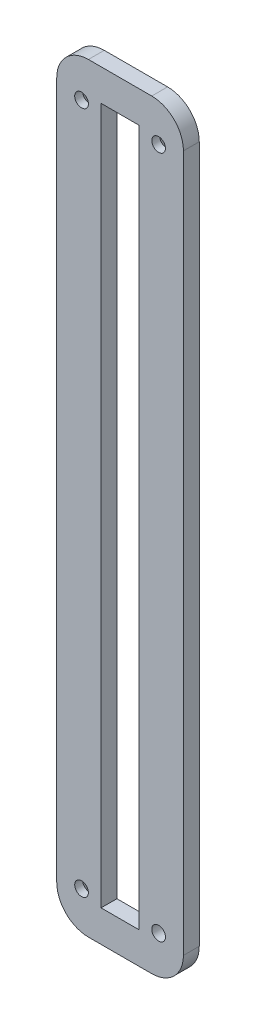
from build123d import *
from build123d.topology import SkipClean

# Parameters (mm, degrees)
SKETCH1_W           = 15.24
SKETCH1_H           = 279.4
BOSS_EXTRUDE3_DEPTH = 6.35
SKETCH2_R           = 2.75
CUT_EXTRUDE1_DEPTH  = 174.437553604
CHAMFER1_SIZE       = 3.175


with BuildPart() as part:
    # Sketch1 → Boss-Extrude3 (new body)
    with BuildSketch(Plane.XY.offset(8)):
        with BuildLine():
            Line((-69.85, -152.4), (-44.45, -152.4))
            ThreePointArc((-44.45, -152.4), (-35.469743879, -148.680256121), (-31.75, -139.7))
            Line((-31.75, -139.7), (-31.75, 139.7))
            ThreePointArc((-31.75, 139.7), (-35.469743879, 148.680256121), (-44.45, 152.4))
            Line((-44.45, 152.4), (-69.85, 152.4))
            ThreePointArc((-69.85, 152.4), (-78.830256121, 148.680256121), (-82.55, 139.7))
            Line((-82.55, 139.7), (-82.55, -139.7))
            ThreePointArc((-82.55, -139.7), (-78.830256121, -148.680256121), (-69.85, -152.4))
        make_face()
        with Locations((-57.15, 0)):
            Rectangle(SKETCH1_W, SKETCH1_H, mode=Mode.SUBTRACT)
        with BuildLine():
            ThreePointArc((-44.45, -136.95), (-39.755456352, -135.005456352), (-41.7, -139.7))
            ThreePointArc((-41.7, -139.7), (-42.505456352, -137.755456352), (-44.45, -136.95))
        make_face(mode=Mode.SUBTRACT)
        with BuildLine():
            ThreePointArc((-72.6, -139.7), (-74.544543648, -135.005456352), (-69.85, -136.95))
            ThreePointArc((-69.85, -136.95), (-71.794543648, -137.755456352), (-72.6, -139.7))
        make_face(mode=Mode.SUBTRACT)
        with BuildLine():
            ThreePointArc((-41.7, 139.7), (-39.755456352, 135.005456352), (-44.45, 136.95))
            ThreePointArc((-44.45, 136.95), (-42.505456352, 137.755456352), (-41.7, 139.7))
        make_face(mode=Mode.SUBTRACT)
        with BuildLine():
            ThreePointArc((-69.85, 136.95), (-74.544543648, 135.005456352), (-72.6, 139.7))
            ThreePointArc((-72.6, 139.7), (-71.794543648, 137.755456352), (-69.85, 136.95))
        make_face(mode=Mode.SUBTRACT)
    extrude(amount=-BOSS_EXTRUDE3_DEPTH)

    # Sketch2 → Cut-Extrude1 (cut, through all)
    with SkipClean():  # the faces are left unmerged after this step: merging them gives an invalid solid
        with BuildSketch(Plane.XY.offset(8)):
            with Locations(Location((-41.7, 136.95, 0), (0, 0, 180))):
                Circle(SKETCH2_R)
            with Locations(Location((-72.6, 136.95, 0), (0, 0, 180))):
                Circle(SKETCH2_R)
            with Locations(Location((-41.7, -136.95, 0), (0, 0, 180))):
                Circle(SKETCH2_R)
            with Locations(Location((-72.6, -136.95, 0), (0, 0, 180))):
                Circle(SKETCH2_R)
        extrude(amount=-CUT_EXTRUDE1_DEPTH, mode=Mode.SUBTRACT)

    # Chamfer1
    chamfer1_edges = [part.edges().sort_by_distance(p)[0] for p in [
        (-39.755456352, 135.005456352, 1.65),
        (-72.6, 134.2, 1.65),
        (-72.6, -134.2, 1.65),
    ]]
    chamfer(chamfer1_edges, length=CHAMFER1_SIZE)


solid = part.part
